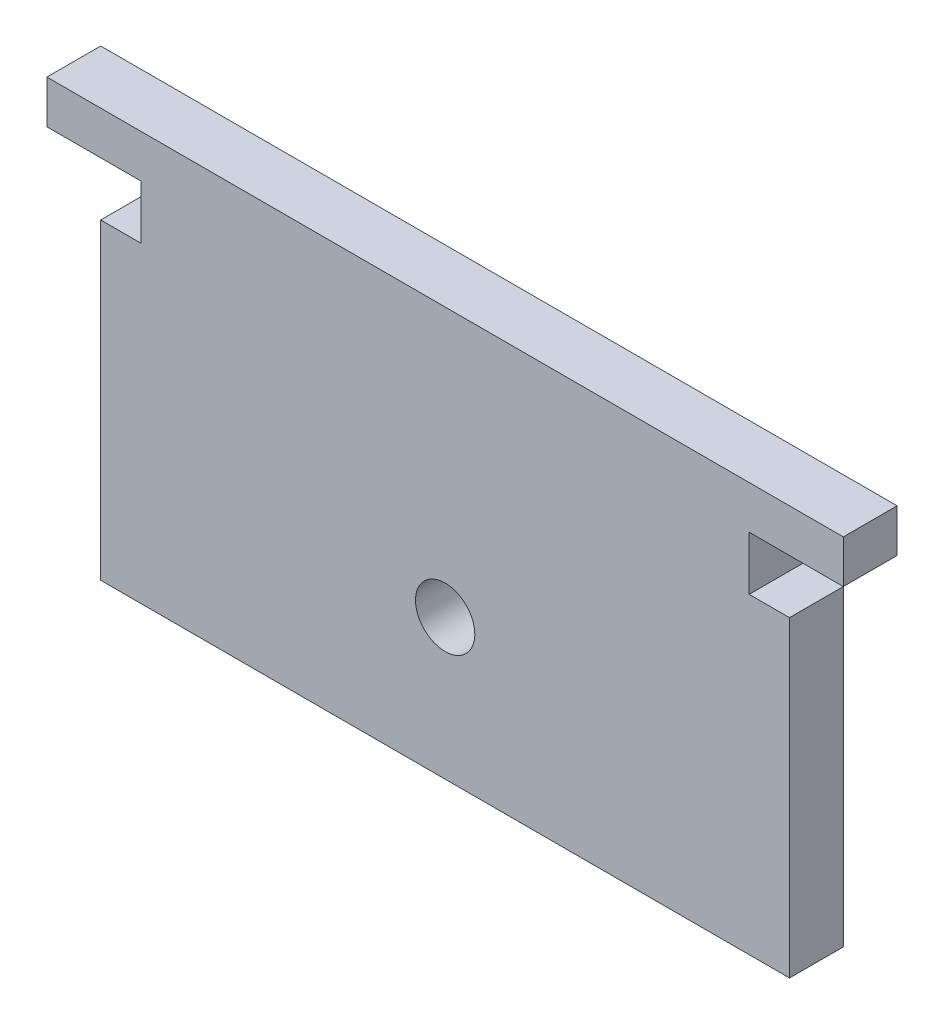
from build123d import *

# Parameters (mm, degrees)
SKETCH1_W           = 93.99016
SKETCH1_H           = 50.8
BOSS_EXTRUDE1_DEPTH = 6.35
SKETCH2_W           = 6.35
SKETCH2_H           = 43.18
CUT_EXTRUDE1_DEPTH  = 6.35
SKETCH3_W           = 93.99016
SKETCH3_H           = 6.35
CUT_EXTRUDE2_DEPTH  = 2.54
SKETCH5_W           = 6.35
SKETCH5_H           = 6.35
CUT_EXTRUDE3_DEPTH  = 4.7625
SKETCH6_R           = 3.5
CUT_EXTRUDE4_DEPTH  = 6.35


with BuildPart() as part:
    # Sketch1 → Boss-Extrude1 (new body)
    with BuildSketch(Plane.XY):
        Rectangle(SKETCH1_W, SKETCH1_H)
    extrude(amount=BOSS_EXTRUDE1_DEPTH)

    # Sketch2 → Cut-Extrude1 (cut)
    with BuildSketch(Plane.XY.offset(6.35)):
        with Locations((-43.82008, -3.81)):
            Rectangle(SKETCH2_W, SKETCH2_H)
        with Locations((43.82008, -3.81)):
            Rectangle(SKETCH2_W, SKETCH2_H)
    extrude(amount=-CUT_EXTRUDE1_DEPTH, mode=Mode.SUBTRACT)

    # Sketch3 → Cut-Extrude2 (cut)
    with BuildSketch(Plane(origin=(0, 25.4, 0), x_dir=(1, 0, 0), z_dir=(0, 1, 0))):
        with Locations((0, -3.175)):
            Rectangle(SKETCH3_W, SKETCH3_H)
    extrude(amount=-CUT_EXTRUDE2_DEPTH, mode=Mode.SUBTRACT)

    # Sketch5 → Cut-Extrude3 (cut)
    with BuildSketch(Plane.ZY.offset(40.64508)):
        with Locations((3.175, 14.605)):
            Rectangle(SKETCH5_W, SKETCH5_H)
    cut_extrude3 = extrude(amount=-CUT_EXTRUDE3_DEPTH, mode=Mode.SUBTRACT)

    # Mirror1: Cut-Extrude3 across plane
    add(cut_extrude3.mirror(Plane(origin=(0, 0, 0), x_dir=(0, 0, 1), z_dir=(1, 0, 0))), mode=Mode.SUBTRACT)

    # Sketch6 → Cut-Extrude4 (cut)
    with BuildSketch(Plane.XY.offset(6.35)):
        with Locations((0.00592, -8.8499)):
            Circle(SKETCH6_R)
    extrude(amount=-CUT_EXTRUDE4_DEPTH, mode=Mode.SUBTRACT)


solid = part.part
